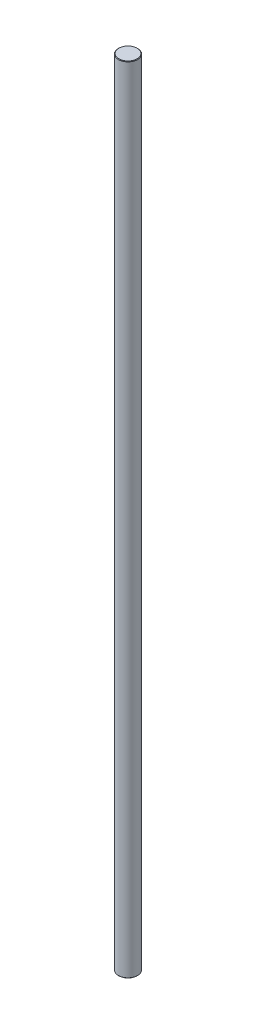
from build123d import *

# Parameters (mm, degrees)
SKETCH1_R           = 4
BOSS_EXTRUDE1_DEPTH = 330
CHAMFER1_SIZE       = 0.2


with BuildPart() as part:
    # Sketch1 → Boss-Extrude1 (new body)
    with BuildSketch(Plane(origin=(0, 0, 0), x_dir=(1, 0, 0), z_dir=(0, 1, 0))):
        with Locations(Location((0, 0, 0), (0, 0, 270))):
            Circle(SKETCH1_R)
    extrude(amount=BOSS_EXTRUDE1_DEPTH)

    # Chamfer1
    chamfer1_edges = [part.edges().sort_by_distance(p)[0] for p in [
        (0, 0, -4),
        (0, 330, -4),
    ]]
    chamfer(chamfer1_edges, length=CHAMFER1_SIZE)


solid = part.part
